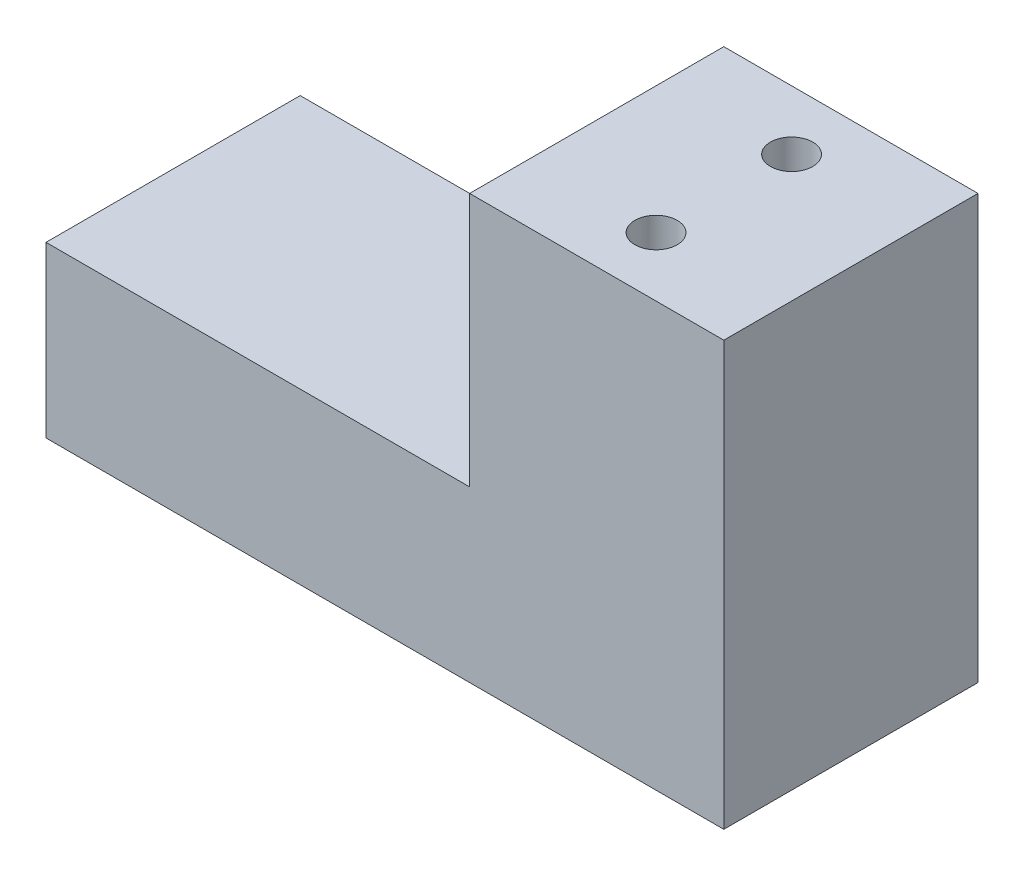
from build123d import *

# Parameters (mm, degrees)
SKETCH1_W           = 80
SKETCH1_H           = 20
BOSS_EXTRUDE1_DEPTH = 30
SKETCH13_W          = 30
SKETCH13_H          = 30
BOSS_EXTRUDE7_DEPTH = 30
SKETCH14_R          = 2.5
CUT_EXTRUDE1_DEPTH  = 10


with BuildPart() as part:
    # Sketch1 → Boss-Extrude1 (new body)
    with BuildSketch(Plane.XY):
        with Locations((40, 10)):
            Rectangle(SKETCH1_W, SKETCH1_H)
    extrude(amount=BOSS_EXTRUDE1_DEPTH)

    # Sketch13 → Boss-Extrude7 (add)
    with BuildSketch(Plane(origin=(0, 20, 0), x_dir=(1, 0, 0), z_dir=(0, 1, 0))):
        with Locations((65, -15)):
            Rectangle(SKETCH13_W, SKETCH13_H)
    extrude(amount=BOSS_EXTRUDE7_DEPTH)

    # Sketch14 → Cut-Extrude1 (cut)
    with BuildSketch(Plane(origin=(0, 50, 0), x_dir=(1, 0, 0), z_dir=(0, 1, 0))):
        with Locations(Location((65, -7, 0), (0, 0, 270))):
            Circle(SKETCH14_R)
        with Locations(Location((65, -23, 0), (0, 0, 270))):
            Circle(SKETCH14_R)
    extrude(amount=-CUT_EXTRUDE1_DEPTH, mode=Mode.SUBTRACT)


solid = part.part
